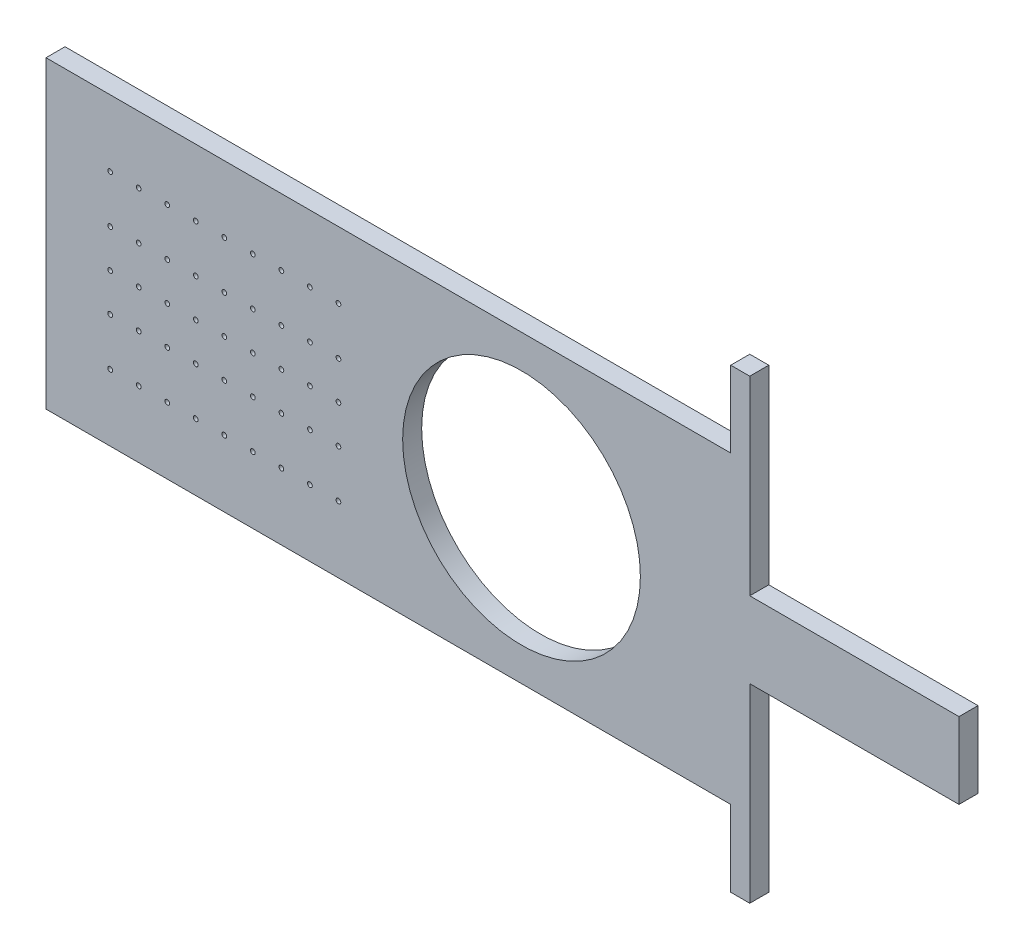
from build123d import *

# Parameters (mm, degrees)
SKETCH1_W           = 228.6
SKETCH1_H           = 101.6
BOSS_EXTRUDE1_DEPTH = 6.35
CUT_EXTRUDE1_DEPTH  = 76.2
SKETCH3_W           = 6.35
SKETCH3_H           = 25.4
BOSS_EXTRUDE2_DEPTH = 76.2
SKETCH5_W           = 6.35
SKETCH5_H           = 6.35
BOSS_EXTRUDE3_DEPTH = 63.5
SKETCH6_W           = 6.35
SKETCH6_H           = 6.35
BOSS_EXTRUDE4_DEPTH = 63.5
SKETCH7_R           = 0.79375
CUT_EXTRUDE3_DEPTH  = 50.8


with BuildPart() as part:
    # Sketch1 → Boss-Extrude1 (new body)
    with BuildSketch(Plane.XY):
        with Locations((114.3, 50.8)):
            Rectangle(SKETCH1_W, SKETCH1_H)
    extrude(amount=BOSS_EXTRUDE1_DEPTH)

    # Sketch2 → Cut-Extrude1 (cut)
    with BuildSketch(Plane.XY.offset(6.35)):
        with BuildLine():
            ThreePointArc((119.0625, 50.8), (158.75, 11.1125), (198.4375, 50.8))
            Line((198.4375, 50.8), (119.0625, 50.8))
        make_face()
        with BuildLine():
            Line((119.0625, 50.8), (198.4375, 50.8))
            ThreePointArc((198.4375, 50.8), (158.75, 90.4875), (119.0625, 50.8))
        make_face()
    extrude(amount=-CUT_EXTRUDE1_DEPTH, mode=Mode.SUBTRACT)

    # Sketch3 → Boss-Extrude2 (add)
    with BuildSketch(Plane(origin=(228.6, 0, 0), x_dir=(0, 0, -1), z_dir=(1, 0, 0))):
        with Locations((-3.175, 50.8)):
            Rectangle(SKETCH3_W, SKETCH3_H)
    extrude(amount=BOSS_EXTRUDE2_DEPTH)

    # Sketch5 → Boss-Extrude3 (add)
    with BuildSketch(Plane(origin=(0, 63.5, 0), x_dir=(1, 0, 0), z_dir=(0, 1, 0))):
        with Locations((231.775, -3.175)):
            Rectangle(SKETCH5_W, SKETCH5_H)
    extrude(amount=BOSS_EXTRUDE3_DEPTH)

    # Sketch6 → Boss-Extrude4 (add)
    with BuildSketch(Plane.XZ.offset(-38.1)):
        with Locations((231.775, 3.175)):
            Rectangle(SKETCH6_W, SKETCH6_H)
    extrude(amount=BOSS_EXTRUDE4_DEPTH)

    # Sketch7 → Cut-Extrude3 (cut)
    with BuildSketch(Plane.XY.offset(6.35)):
        with Locations(Location((59.53125, 50.8, 0), (0, 0, 180))):
            Circle(SKETCH7_R)
        with Locations((59.53125, 79.375)):
            Circle(SKETCH7_R)
        with Locations(Location((88.10625, 50.8, 0), (0, 0, 180))):
            Circle(SKETCH7_R)
        with Locations((59.53125, 38.1)):
            Circle(SKETCH7_R)
        with Locations((30.95625, 50.8)):
            Circle(SKETCH7_R)
        with Locations((50.00625, 50.8)):
            Circle(SKETCH7_R)
        with Locations(Location((59.53125, 63.5, 0), (0, 0, 180))):
            Circle(SKETCH7_R)
        with Locations(Location((78.58125, 50.8, 0), (0, 0, 180))):
            Circle(SKETCH7_R)
        with Locations(Location((59.53125, 22.225, 0), (0, 0, 180))):
            Circle(SKETCH7_R)
        with Locations(Location((97.63125, 50.8, 0), (0, 0, 180))):
            Circle(SKETCH7_R)
        with Locations((21.43125, 50.8)):
            Circle(SKETCH7_R)
        with Locations((69.05625, 79.375)):
            Circle(SKETCH7_R)
        with Locations((40.48125, 50.8)):
            Circle(SKETCH7_R)
        with Locations(Location((69.05625, 63.5, 0), (0, 0, 180))):
            Circle(SKETCH7_R)
        with Locations(Location((69.05625, 50.8, 0), (0, 0, 180))):
            Circle(SKETCH7_R)
        with Locations((69.05625, 38.1)):
            Circle(SKETCH7_R)
        with Locations(Location((69.05625, 22.225, 0), (0, 0, 180))):
            Circle(SKETCH7_R)
        with Locations((78.58125, 79.375)):
            Circle(SKETCH7_R)
        with Locations(Location((78.58125, 63.5, 0), (0, 0, 180))):
            Circle(SKETCH7_R)
        with Locations((78.58125, 38.1)):
            Circle(SKETCH7_R)
        with Locations(Location((78.58125, 22.225, 0), (0, 0, 180))):
            Circle(SKETCH7_R)
        with Locations((88.10625, 79.375)):
            Circle(SKETCH7_R)
        with Locations(Location((88.10625, 63.5, 0), (0, 0, 180))):
            Circle(SKETCH7_R)
        with Locations((88.10625, 38.1)):
            Circle(SKETCH7_R)
        with Locations(Location((88.10625, 22.225, 0), (0, 0, 180))):
            Circle(SKETCH7_R)
        with Locations((97.63125, 79.375)):
            Circle(SKETCH7_R)
        with Locations(Location((97.63125, 63.5, 0), (0, 0, 180))):
            Circle(SKETCH7_R)
        with Locations((97.63125, 38.1)):
            Circle(SKETCH7_R)
        with Locations(Location((97.63125, 22.225, 0), (0, 0, 180))):
            Circle(SKETCH7_R)
        with Locations((21.43125, 22.225)):
            Circle(SKETCH7_R)
        with Locations(Location((21.43125, 38.1, 0), (0, 0, 180))):
            Circle(SKETCH7_R)
        with Locations((21.43125, 63.5)):
            Circle(SKETCH7_R)
        with Locations(Location((21.43125, 79.375, 0), (0, 0, 180))):
            Circle(SKETCH7_R)
        with Locations((30.95625, 22.225)):
            Circle(SKETCH7_R)
        with Locations(Location((30.95625, 38.1, 0), (0, 0, 180))):
            Circle(SKETCH7_R)
        with Locations((30.95625, 63.5)):
            Circle(SKETCH7_R)
        with Locations(Location((30.95625, 79.375, 0), (0, 0, 180))):
            Circle(SKETCH7_R)
        with Locations((40.48125, 22.225)):
            Circle(SKETCH7_R)
        with Locations(Location((40.48125, 38.1, 0), (0, 0, 180))):
            Circle(SKETCH7_R)
        with Locations((40.48125, 63.5)):
            Circle(SKETCH7_R)
        with Locations(Location((40.48125, 79.375, 0), (0, 0, 180))):
            Circle(SKETCH7_R)
        with Locations((50.00625, 22.225)):
            Circle(SKETCH7_R)
        with Locations(Location((50.00625, 38.1, 0), (0, 0, 180))):
            Circle(SKETCH7_R)
        with Locations((50.00625, 63.5)):
            Circle(SKETCH7_R)
        with Locations(Location((50.00625, 79.375, 0), (0, 0, 180))):
            Circle(SKETCH7_R)
    extrude(amount=-CUT_EXTRUDE3_DEPTH, mode=Mode.SUBTRACT)


solid = part.part
